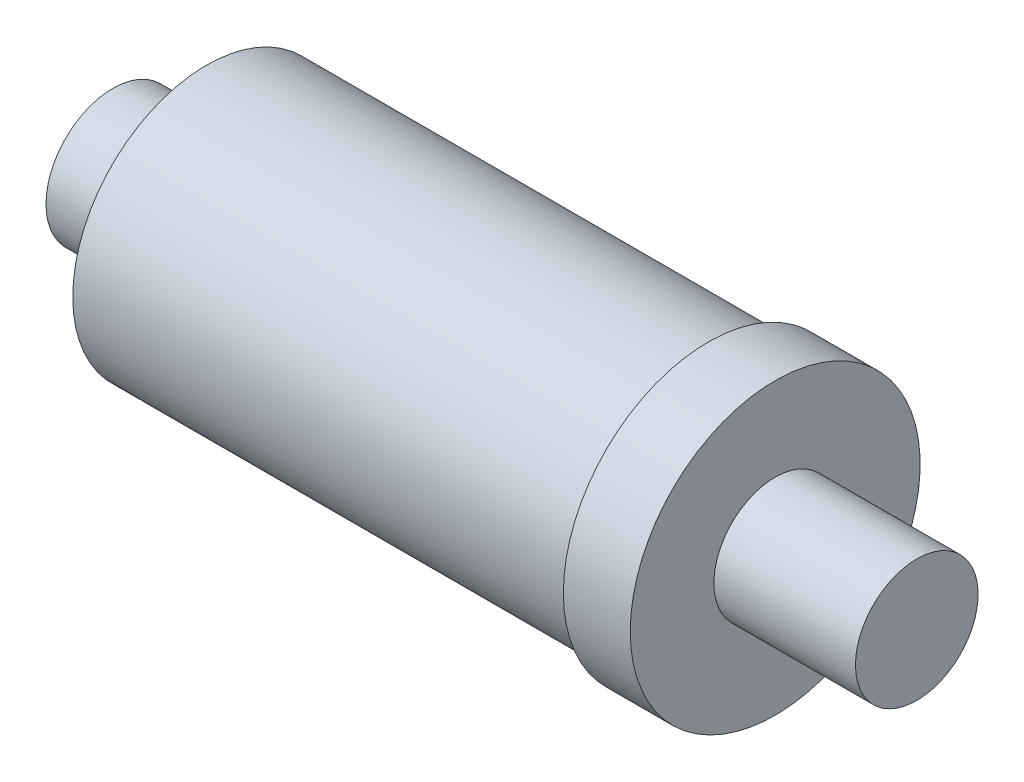
from build123d import *


with BuildPart() as part:
    # Sensor_Turck Sketch → Sensor_Turck (revolve)
    with BuildSketch(Plane.XY):
        Polygon((12.7, 0), (12.7, 5.5), (0, 5.5), (0, 13), (-6, 13), (-6, 12), (-51, 12), (-51, 6), (-59.4, 6), (-59.4, 0), align=None)
    revolve(axis=Axis((-1000, 0, 0), (1, 0, 0)))


solid = part.part
